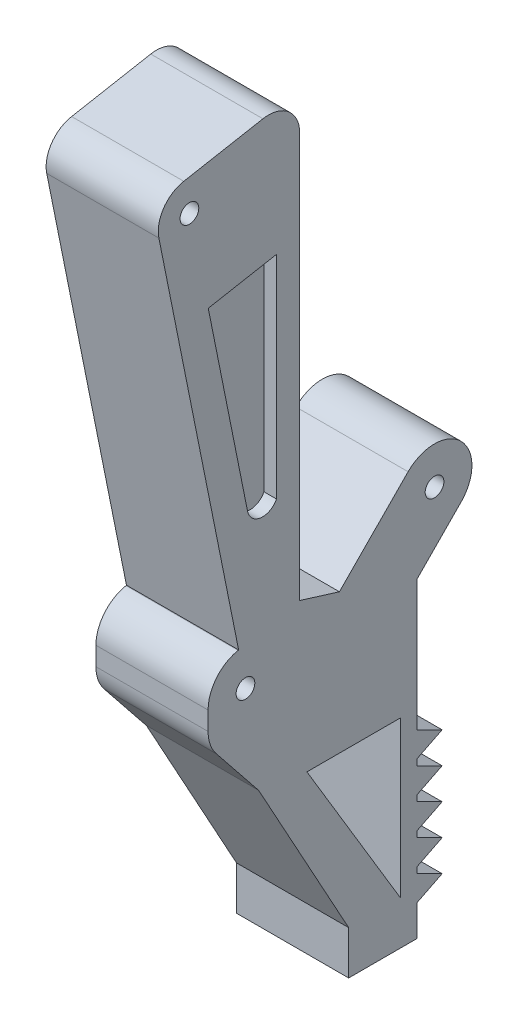
from build123d import *

# Parameters (mm, degrees)
BOSS_EXTRUDE1_DEPTH = 9
CUT_EXTRUDE1_DEPTH  = 25
BOSS_EXTRUDE2_DEPTH = 18
LPATTERN1_COUNT     = 5
LPATTERN1_PITCH     = 5
FILLET1_R           = 6
FILLET2_R           = 5
SKETCH4_R           = 1.5
CUT_EXTRUDE2_DEPTH  = 25
SKETCH5_R           = 1.5
CUT_EXTRUDE3_DEPTH  = 25
CUT_EXTRUDE4_DEPTH  = 2
CUT_EXTRUDE5_DEPTH  = 2


with BuildPart() as part:
    # Sketch1 → Boss-Extrude1 (new, symmetric)
    with BuildSketch(Plane(origin=(0, 0, 0), x_dir=(0, 0, -1), z_dir=(1, 0, 0))):
        Polygon((72.723807427, -0.926412344), (62.92004934, -2.897789372), (49.12041015, 65.728517233), (72.723807427, 70.073587656), align=None)
        Polygon((91.582675421, -7.328280768), (98.60593402, -0.20972483), (90.120652646, 8.275556545), (79.096697455, -2.897980722), (72.723807427, -0.926412344), (62.92004934, -2.897789372), (58.018170297, -3.883477885), (58.018170297, -13.883477885), (66.142055029, -24.032492461), (80.582675421, -50.328280768), (80.582675421, -57.328280768), (91.582675421, -57.328280768), align=None)
        with BuildLine():
            ThreePointArc((98.60593402, -0.20972483), (98.60593402, 8.275556545), (90.120652646, 8.275556545))
            Line((90.120652646, 8.275556545), (98.60593402, -0.20972483))
        make_face()
    extrude(amount=BOSS_EXTRUDE1_DEPTH, both=True)

    # Sketch2 → Cut-Extrude1 (cut)
    with BuildSketch(Plane(origin=(9, 0, 0), x_dir=(0, 0, -1), z_dir=(1, 0, 0))):
        Polygon((88.882675421, -50.328280768), (88.882675421, -25.328280768), (73.882675421, -25.328280768), align=None)
    extrude(amount=-CUT_EXTRUDE1_DEPTH, mode=Mode.SUBTRACT)

    # Sketch3 → Boss-Extrude2 (add)
    with BuildSketch(Plane(origin=(9, 0, 0), x_dir=(0, 0, -1), z_dir=(1, 0, 0))):
        Polygon((91.582675421, -50.328280768), (91.582675421, -52.328280768), (95.582675421, -50.328280768), align=None)
        Polygon((91.582675421, -50.328280768), (95.582675421, -50.328280768), (91.582675421, -48.328280768), align=None)
    boss_extrude2 = extrude(amount=-BOSS_EXTRUDE2_DEPTH)

    # LPattern1: Boss-Extrude2 ×5
    with Locations(*[(0, i * LPATTERN1_PITCH, 0) for i in range(1, LPATTERN1_COUNT)]):
        add(boss_extrude2)

    # Fillet1
    fillet1_edges = [part.edges().sort_by_distance(p)[0] for p in [
        (0, -13.883477885, -58.018170297),
        (0, -3.883477885, -58.018170297),
    ]]
    fillet(fillet1_edges, radius=FILLET1_R)

    # Fillet2
    fillet2_edges = [part.edges().sort_by_distance(p)[0] for p in [
        (0, 65.728517233, -49.12041015),
        (0, 70.073587656, -72.723807427),
    ]]
    fillet(fillet2_edges, radius=FILLET2_R)

    # Sketch4 → Cut-Extrude2 (cut)
    with BuildSketch(Plane(origin=(9, 0, 0), x_dir=(0, 0, -1), z_dir=(1, 0, 0))):
        with Locations((55.024265961, 61.731324387)):
            Circle(SKETCH4_R)
    extrude(amount=-CUT_EXTRUDE2_DEPTH, mode=Mode.SUBTRACT)

    # Sketch5 → Cut-Extrude3 (cut)
    with BuildSketch(Plane(origin=(9, 0, 0), x_dir=(0, 0, -1), z_dir=(1, 0, 0))):
        with Locations((94.363293333, 4.032915857)):
            Circle(SKETCH5_R)
        with Locations((64.018170297, -8.79707708)):
            Circle(SKETCH5_R)
    extrude(amount=-CUT_EXTRUDE3_DEPTH, mode=Mode.SUBTRACT)

    # Sketch6 → Cut-Extrude4 (cut)
    with BuildSketch(Plane(origin=(9, 0, 0), x_dir=(0, 0, -1), z_dir=(1, 0, 0))):
        with BuildLine():
            Line((68.990160428, 15.050217447), (68.990160428, 49.050217447))
            Line((68.990160428, 49.050217447), (58.046044594, 47.035551784))
            Line((58.046044594, 47.035551784), (64.354451081, 15.663525908))
            ThreePointArc((64.354451081, 15.663525908), (66.453192239, 13.700695979), (68.990160428, 15.050217447))
        make_face()
    extrude(amount=-CUT_EXTRUDE4_DEPTH, mode=Mode.SUBTRACT)

    # Sketch7 → Cut-Extrude5 (cut)
    with BuildSketch(Plane.ZY.offset(9)):
        with BuildLine():
            Line((-68.307430595, 48.924535996), (-56.93452281, 46.830935459))
            Line((-56.93452281, 46.830935459), (-63.369204726, 14.830935459))
            ThreePointArc((-63.369204726, 14.830935459), (-65.88423927, 12.454979569), (-68.307430595, 14.924535996))
            Line((-68.307430595, 14.924535996), (-68.307430595, 48.924535996))
        make_face()
    extrude(amount=-CUT_EXTRUDE5_DEPTH, mode=Mode.SUBTRACT)


solid = part.part
